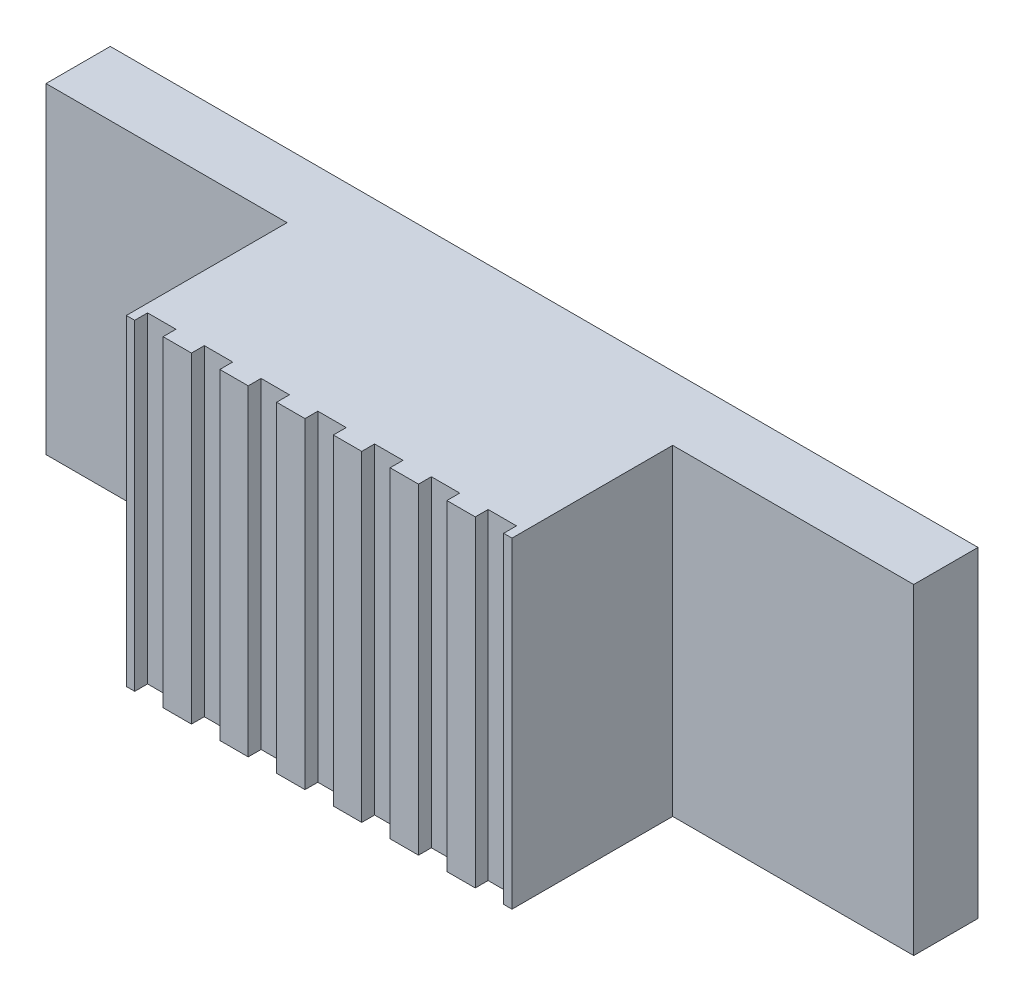
from build123d import *

# Parameters (mm, degrees)
SKETCH1_W           = 6
SKETCH1_H           = 5
BOSS_EXTRUDE1_DEPTH = 3.5
SKETCH1_3_W         = 3.75
SKETCH1_3_H         = 5
BOSS_EXTRUDE2_DEPTH = 1
CUT_EXTRUDE1_START  = -2.5
SKETCH2_W           = 2.1
SKETCH2_H           = 3
CUT_EXTRUDE1_DEPTH  = 2.5
SKETCH3_W           = 0.441524735
SKETCH3_H           = 5
SKETCH3_W_2         = 0.441524734
CUT_EXTRUDE2_DEPTH  = 0.2


with BuildPart() as part:
    # Sketch1 → Boss-Extrude1 (new body)
    with BuildSketch(Plane.XY):
        Rectangle(SKETCH1_W, SKETCH1_H)
    extrude(amount=BOSS_EXTRUDE1_DEPTH)

    # Sketch1<3> → Boss-Extrude2 (add)
    with BuildSketch(Plane.XY):
        with Locations((-4.875, 0)):
            Rectangle(SKETCH1_3_W, SKETCH1_3_H)
        with Locations((4.875, 0)):
            Rectangle(SKETCH1_3_W, SKETCH1_3_H)
    extrude(amount=BOSS_EXTRUDE2_DEPTH)

    # Sketch2 → Cut-Extrude1 (cut)
    with BuildSketch(Plane(origin=(0, 0, 0), x_dir=(-1, 0, 0), z_dir=(0, 0, -1)).offset(CUT_EXTRUDE1_START)):
        Rectangle(SKETCH2_W, SKETCH2_H)
    extrude(amount=CUT_EXTRUDE1_DEPTH, mode=Mode.SUBTRACT)

    # Sketch3 → Cut-Extrude2 (cut)
    with BuildSketch(Plane.XY.offset(3.5)):
        with Locations((-2.64914841, 0)):
            Rectangle(SKETCH3_W, SKETCH3_H)
        with Locations((-1.766098939, 0)):
            Rectangle(SKETCH3_W, SKETCH3_H)
        with Locations((-0.88304947, 0)):
            Rectangle(SKETCH3_W, SKETCH3_H)
        Rectangle(SKETCH3_W_2, SKETCH3_H)
        with Locations((0.88304947, 0)):
            Rectangle(SKETCH3_W, SKETCH3_H)
        with Locations((1.766098939, 0)):
            Rectangle(SKETCH3_W, SKETCH3_H)
        with Locations((2.64914841, 0)):
            Rectangle(SKETCH3_W, SKETCH3_H)
    extrude(amount=-CUT_EXTRUDE2_DEPTH, mode=Mode.SUBTRACT)


solid = part.part
